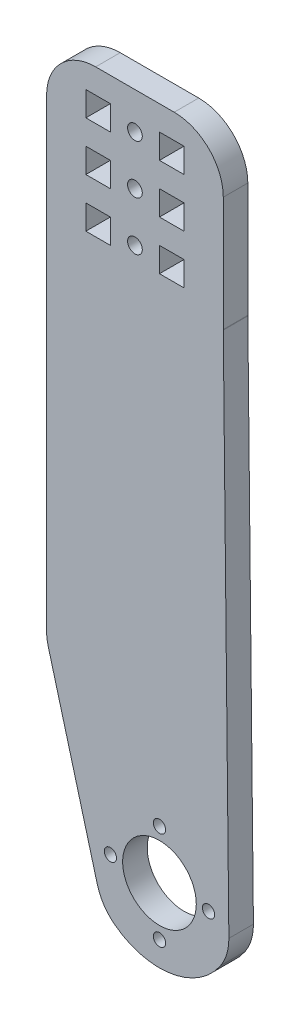
from build123d import *

# Parameters (mm, degrees)
SKETCH1_R           = 7.5
SKETCH1_R_2         = 1.25
SKETCH1_R_3         = 1.5
SKETCH1_W           = 5
SKETCH1_H           = 5
BOSS_EXTRUDE1_DEPTH = 5
FILLET1_R           = 10
FILLET2_R           = 10


with BuildPart() as part:
    # Sketch1 → Boss-Extrude1 (new body)
    with BuildSketch(Plane.XY):
        with BuildLine():
            Line((0, 44.138584039), (10.984892076, 3.520179201))
            ThreePointArc((10.984892076, 3.520179201), (25.289734382, -2.324207111), (37.164554201, 7.563867476))
            Line((37.164554201, 7.563867476), (36, 116.603941586))
            Line((36, 116.603941586), (36, 150))
            Line((36, 150), (0, 150))
            Line((0, 150), (0, 44.138584039))
        make_face()
        with Locations((23, 12.5)):
            Circle(SKETCH1_R, mode=Mode.SUBTRACT)
        with Locations((23, 22.5)):
            Circle(SKETCH1_R_2, mode=Mode.SUBTRACT)
        with Locations((13, 12.5)):
            Circle(SKETCH1_R_2, mode=Mode.SUBTRACT)
        with Locations((23, 2.5)):
            Circle(SKETCH1_R_2, mode=Mode.SUBTRACT)
        with Locations((33, 12.5)):
            Circle(SKETCH1_R_2, mode=Mode.SUBTRACT)
        with Locations((18, 142.5)):
            Circle(SKETCH1_R_3, mode=Mode.SUBTRACT)
        with Locations((18, 122.5)):
            Circle(SKETCH1_R_3, mode=Mode.SUBTRACT)
        with Locations((18, 132.5)):
            Circle(SKETCH1_R_3, mode=Mode.SUBTRACT)
        with Locations((10.5, 142.5)):
            Rectangle(SKETCH1_W, SKETCH1_H, mode=Mode.SUBTRACT)
        with Locations((25.5, 142.5)):
            Rectangle(SKETCH1_W, SKETCH1_H, mode=Mode.SUBTRACT)
        with Locations((10.5, 122.5)):
            Rectangle(SKETCH1_W, SKETCH1_H, mode=Mode.SUBTRACT)
        with Locations((25.5, 122.5)):
            Rectangle(SKETCH1_W, SKETCH1_H, mode=Mode.SUBTRACT)
        with Locations((10.5, 132.5)):
            Rectangle(SKETCH1_W, SKETCH1_H, mode=Mode.SUBTRACT)
        with Locations((25.5, 132.5)):
            Rectangle(SKETCH1_W, SKETCH1_H, mode=Mode.SUBTRACT)
    extrude(amount=BOSS_EXTRUDE1_DEPTH)

    # Fillet1
    fillet1_edges = [part.edges().sort_by_distance(p)[0] for p in [
        (0, 150, 2.5),
        (36, 150, 2.5),
    ]]
    fillet(fillet1_edges, radius=FILLET1_R)

    # Fillet2
    fillet2_edges = [part.edges().sort_by_distance(p)[0] for p in [
        (10.984892076, 3.520179201, 2.5),
        (0, 44.138584039, 2.5),
        (36, 116.603941586, 2.5),
        (37.164554201, 7.563867476, 2.5),
    ]]
    fillet(fillet2_edges, radius=FILLET2_R)


solid = part.part
